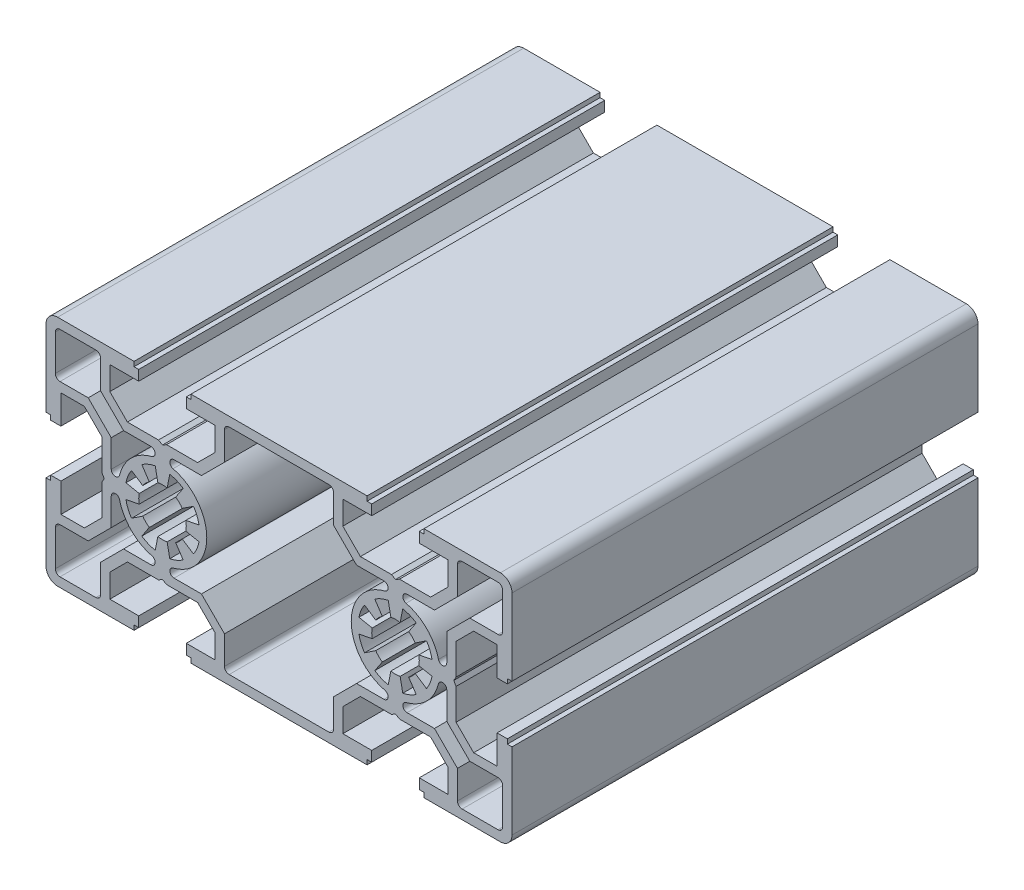
from build123d import *

# Parameters (mm, degrees)
EXTRUDE_1_DEPTH = 100


with BuildPart() as part:
    # 草图1 → 凸台-拉伸1 (new body)
    with BuildSketch(Plane.XY):
        with BuildLine():
            Line((75, 6.1), (75, 22.5))
            ThreePointArc((75, 22.5), (74.267766953, 24.267766953), (72.5, 25))
            Line((72.5, 25), (56.1, 25))
            Line((56.1, 25), (56.1, 24))
            Line((56.1, 24), (55.1, 24))
            Line((55.1, 24), (55.1, 21.8))
            Line((55.1, 21.8), (61.3, 21.8))
            Line((61.3, 21.8), (61.3, 16.769848481))
            Line((61.3, 16.769848481), (57.530151519, 13))
            Line((57.530151519, 13), (50.866025404, 13))
            Line((50.866025404, 13), (50, 12.5))
            Line((50, 12.5), (49.133974596, 13))
            Line((49.133974596, 13), (42.469848481, 13))
            Line((42.469848481, 13), (38.7, 16.769848481))
            Line((38.7, 16.769848481), (38.7, 21.8))
            Line((38.7, 21.8), (44.9, 21.8))
            Line((44.9, 21.8), (44.9, 24))
            Line((44.9, 24), (43.9, 24))
            Line((43.9, 24), (43.9, 25))
            Line((43.9, 25), (6.1, 25))
            Line((6.1, 25), (6.1, 24))
            Line((6.1, 24), (5.1, 24))
            Line((5.1, 24), (5.1, 21.8))
            Line((5.1, 21.8), (11.3, 21.8))
            Line((11.3, 21.8), (11.3, 16.769848481))
            Line((11.3, 16.769848481), (7.530151519, 13))
            Line((7.530151519, 13), (0.866025404, 13))
            Line((0.866025404, 13), (0, 12.5))
            Line((0, 12.5), (-0.866025404, 13))
            Line((-0.866025404, 13), (-7.530151519, 13))
            Line((-7.530151519, 13), (-11.3, 16.769848481))
            Line((-11.3, 16.769848481), (-11.3, 21.8))
            Line((-11.3, 21.8), (-5.1, 21.8))
            Line((-5.1, 21.8), (-5.1, 24))
            Line((-5.1, 24), (-6.1, 24))
            Line((-6.1, 24), (-6.1, 25))
            Line((-6.1, 25), (-22.5, 25))
            ThreePointArc((-22.5, 25), (-24.267766953, 24.267766953), (-25, 22.5))
            Line((-25, 22.5), (-25, 6.1))
            Line((-25, 6.1), (-24, 6.1))
            Line((-24, 6.1), (-24, 5.1))
            Line((-24, 5.1), (-21.8, 5.1))
            Line((-21.8, 5.1), (-21.8, 11.3))
            Line((-21.8, 11.3), (-16.769848481, 11.3))
            Line((-16.769848481, 11.3), (-13, 7.530151519))
            Line((-13, 7.530151519), (-13, 0.866025404))
            Line((-13, 0.866025404), (-12.5, 0))
            Line((-12.5, 0), (-13, -0.866025404))
            Line((-13, -0.866025404), (-13, -7.530151519))
            Line((-13, -7.530151519), (-16.769848481, -11.3))
            Line((-16.769848481, -11.3), (-21.8, -11.3))
            Line((-21.8, -11.3), (-21.8, -5.1))
            Line((-21.8, -5.1), (-24, -5.1))
            Line((-24, -5.1), (-24, -6.1))
            Line((-24, -6.1), (-25, -6.1))
            Line((-25, -6.1), (-25, -22.5))
            ThreePointArc((-25, -22.5), (-24.267766953, -24.267766953), (-22.5, -25))
            Line((-22.5, -25), (-6.1, -25))
            Line((-6.1, -25), (-6.1, -24))
            Line((-6.1, -24), (-5.1, -24))
            Line((-5.1, -24), (-5.1, -21.8))
            Line((-5.1, -21.8), (-11.3, -21.8))
            Line((-11.3, -21.8), (-11.3, -16.769848481))
            Line((-11.3, -16.769848481), (-7.530151519, -13))
            Line((-7.530151519, -13), (-0.866025404, -13))
            Line((-0.866025404, -13), (0, -12.5))
            Line((0, -12.5), (0.866025404, -13))
            Line((0.866025404, -13), (7.530151519, -13))
            Line((7.530151519, -13), (11.3, -16.769848481))
            Line((11.3, -16.769848481), (11.3, -21.8))
            Line((11.3, -21.8), (5.1, -21.8))
            Line((5.1, -21.8), (5.1, -24))
            Line((5.1, -24), (6.1, -24))
            Line((6.1, -24), (6.1, -25))
            Line((6.1, -25), (43.9, -25))
            Line((43.9, -25), (43.9, -24))
            Line((43.9, -24), (44.9, -24))
            Line((44.9, -24), (44.9, -21.8))
            Line((44.9, -21.8), (38.7, -21.8))
            Line((38.7, -21.8), (38.7, -16.769848481))
            Line((38.7, -16.769848481), (42.469848481, -13))
            Line((42.469848481, -13), (49.133974596, -13))
            Line((49.133974596, -13), (50, -12.5))
            Line((50, -12.5), (50.866025404, -13))
            Line((50.866025404, -13), (57.530151519, -13))
            Line((57.530151519, -13), (61.3, -16.769848481))
            Line((61.3, -16.769848481), (61.3, -21.8))
            Line((61.3, -21.8), (55.1, -21.8))
            Line((55.1, -21.8), (55.1, -24))
            Line((55.1, -24), (56.1, -24))
            Line((56.1, -24), (56.1, -25))
            Line((56.1, -25), (72.5, -25))
            ThreePointArc((72.5, -25), (74.267766953, -24.267766953), (75, -22.5))
            Line((75, -22.5), (75, -6.1))
            Line((75, -6.1), (74, -6.1))
            Line((74, -6.1), (74, -5.1))
            Line((74, -5.1), (71.8, -5.1))
            Line((71.8, -5.1), (71.8, -11.3))
            Line((71.8, -11.3), (66.769848481, -11.3))
            Line((66.769848481, -11.3), (63, -7.530151519))
            Line((63, -7.530151519), (63, -0.866025404))
            Line((63, -0.866025404), (62.5, 0))
            Line((62.5, 0), (63, 0.866025404))
            Line((63, 0.866025404), (63, 7.530151519))
            Line((63, 7.530151519), (66.769848481, 11.3))
            Line((66.769848481, 11.3), (71.8, 11.3))
            Line((71.8, 11.3), (71.8, 5.1))
            Line((71.8, 5.1), (74, 5.1))
            Line((74, 5.1), (74, 6.1))
            Line((74, 6.1), (75, 6.1))
        make_face()
        with BuildLine():
            Line((61, -2.479919354), (61, -8.358578644))
            Line((61, -8.358578644), (65.941421356, -13.3))
            Line((65.941421356, -13.3), (72, -13.3))
            ThreePointArc((72, -13.3), (72.707106781, -13.592893219), (73, -14.3))
            Line((73, -14.3), (73, -22))
            ThreePointArc((73, -22), (72.707106781, -22.707106781), (72, -23))
            Line((72, -23), (64.3, -23))
            ThreePointArc((64.3, -23), (63.592893219, -22.707106781), (63.3, -22))
            Line((63.3, -22), (63.3, -15.941421356))
            Line((63.3, -15.941421356), (58.358578644, -11))
            Line((58.358578644, -11), (52.479919354, -11))
            ThreePointArc((52.479919354, -11), (51.586433311, -10.208086504), (52.265310948, -9.225961538))
            ThreePointArc((52.265310948, -9.225961538), (56.717514421, -6.717514421), (59.225961538, -2.265310948))
            ThreePointArc((59.225961538, -2.265310948), (60.208086504, -1.586433311), (61, -2.479919354))
        make_face(mode=Mode.SUBTRACT)
        with BuildLine():
            Line((52.833408188, 4.240495023), (54.444561864, 6.651756898))
            ThreePointArc((54.444561864, 6.651756898), (53.061467459, 7.39103626), (51.560722576, 7.846282243))
            Line((51.560722576, 7.846282243), (50.994960642, 5.00200493))
            ThreePointArc((50.994960642, 5.00200493), (50, 5.1), (49.005039358, 5.00200493))
            Line((49.005039358, 5.00200493), (48.439277424, 7.846282243))
            ThreePointArc((48.439277424, 7.846282243), (46.938532541, 7.39103626), (45.555438136, 6.651756898))
            Line((45.555438136, 6.651756898), (47.166591812, 4.240495023))
            ThreePointArc((47.166591812, 4.240495023), (46.393755416, 3.606244584), (45.759504977, 2.833408188))
            Line((45.759504977, 2.833408188), (43.348243102, 4.444561864))
            ThreePointArc((43.348243102, 4.444561864), (42.60896374, 3.061467459), (42.153717757, 1.560722576))
            Line((42.153717757, 1.560722576), (44.99799507, 0.994960642))
            ThreePointArc((44.99799507, 0.994960642), (44.9, 0), (44.99799507, -0.994960642))
            Line((44.99799507, -0.994960642), (42.153717757, -1.560722576))
            ThreePointArc((42.153717757, -1.560722576), (42.60896374, -3.061467459), (43.348243102, -4.444561864))
            Line((43.348243102, -4.444561864), (45.759504977, -2.833408188))
            ThreePointArc((45.759504977, -2.833408188), (46.393755416, -3.606244584), (47.166591812, -4.240495023))
            Line((47.166591812, -4.240495023), (45.555438136, -6.651756898))
            ThreePointArc((45.555438136, -6.651756898), (46.938532541, -7.39103626), (48.439277424, -7.846282243))
            Line((48.439277424, -7.846282243), (49.005039358, -5.00200493))
            ThreePointArc((49.005039358, -5.00200493), (50, -5.1), (50.994960642, -5.00200493))
            Line((50.994960642, -5.00200493), (51.560722576, -7.846282243))
            ThreePointArc((51.560722576, -7.846282243), (53.061467459, -7.39103626), (54.444561864, -6.651756898))
            Line((54.444561864, -6.651756898), (52.833408188, -4.240495023))
            ThreePointArc((52.833408188, -4.240495023), (53.606244584, -3.606244584), (54.240495023, -2.833408188))
            Line((54.240495023, -2.833408188), (56.651756898, -4.444561864))
            ThreePointArc((56.651756898, -4.444561864), (57.39103626, -3.061467459), (57.846282243, -1.560722576))
            Line((57.846282243, -1.560722576), (55.00200493, -0.994960642))
            ThreePointArc((55.00200493, -0.994960642), (55.1, 0), (55.00200493, 0.994960642))
            Line((55.00200493, 0.994960642), (57.846282243, 1.560722576))
            ThreePointArc((57.846282243, 1.560722576), (57.39103626, 3.061467459), (56.651756898, 4.444561864))
            Line((56.651756898, 4.444561864), (54.240495023, 2.833408188))
            ThreePointArc((54.240495023, 2.833408188), (53.606244584, 3.606244584), (52.833408188, 4.240495023))
        make_face(mode=Mode.SUBTRACT)
        with BuildLine():
            Line((65.941421356, 13.3), (61, 8.358578644))
            Line((61, 8.358578644), (61, 2.479919354))
            ThreePointArc((61, 2.479919354), (60.208086504, 1.586433311), (59.225961538, 2.265310948))
            ThreePointArc((59.225961538, 2.265310948), (56.717514421, 6.717514421), (52.265310948, 9.225961538))
            ThreePointArc((52.265310948, 9.225961538), (51.586433311, 10.208086504), (52.479919354, 11))
            Line((52.479919354, 11), (58.358578644, 11))
            Line((58.358578644, 11), (63.3, 15.941421356))
            Line((63.3, 15.941421356), (63.3, 22))
            ThreePointArc((63.3, 22), (63.592893219, 22.707106781), (64.3, 23))
            Line((64.3, 23), (72, 23))
            ThreePointArc((72, 23), (72.707106781, 22.707106781), (73, 22))
            Line((73, 22), (73, 14.3))
            ThreePointArc((73, 14.3), (72.707106781, 13.592893219), (72, 13.3))
            Line((72, 13.3), (65.941421356, 13.3))
        make_face(mode=Mode.SUBTRACT)
        with BuildLine():
            Line((47.520080646, -11), (41.641421356, -11))
            Line((41.641421356, -11), (36.7, -15.941421356))
            Line((36.7, -15.941421356), (36.7, -22))
            ThreePointArc((36.7, -22), (36.407106781, -22.707106781), (35.7, -23))
            Line((35.7, -23), (14.3, -23))
            ThreePointArc((14.3, -23), (13.592893219, -22.707106781), (13.3, -22))
            Line((13.3, -22), (13.3, -15.941421356))
            Line((13.3, -15.941421356), (8.358578644, -11))
            Line((8.358578644, -11), (2.479919354, -11))
            ThreePointArc((2.479919354, -11), (1.586433311, -10.208086504), (2.265310948, -9.225961538))
            ThreePointArc((2.265310948, -9.225961538), (8.1255567, -4.921923234), (9.225961538, 2.265310948))
            ThreePointArc((9.225961538, 2.265310948), (6.717514421, 6.717514421), (2.265310948, 9.225961538))
            ThreePointArc((2.265310948, 9.225961538), (1.586433311, 10.208086504), (2.479919354, 11))
            Line((2.479919354, 11), (8.358578644, 11))
            Line((8.358578644, 11), (13.3, 15.941421356))
            Line((13.3, 15.941421356), (13.3, 22))
            ThreePointArc((13.3, 22), (13.592893219, 22.707106781), (14.3, 23))
            Line((14.3, 23), (35.7, 23))
            ThreePointArc((35.7, 23), (36.407106781, 22.707106781), (36.7, 22))
            Line((36.7, 22), (36.7, 15.941421356))
            Line((36.7, 15.941421356), (41.641421356, 11))
            Line((41.641421356, 11), (47.520080646, 11))
            ThreePointArc((47.520080646, 11), (48.413566689, 10.208086504), (47.734689052, 9.225961538))
            ThreePointArc((47.734689052, 9.225961538), (43.282485579, 6.717514421), (40.774038462, 2.265310948))
            ThreePointArc((40.774038462, 2.265310948), (41.8744433, -4.921923234), (47.734689052, -9.225961538))
            ThreePointArc((47.734689052, -9.225961538), (48.413566689, -10.208086504), (47.520080646, -11))
        make_face(mode=Mode.SUBTRACT)
        with BuildLine():
            Line((-11, -2.479919354), (-11, -8.358578644))
            Line((-11, -8.358578644), (-15.941421356, -13.3))
            Line((-15.941421356, -13.3), (-22, -13.3))
            ThreePointArc((-22, -13.3), (-22.707106781, -13.592893219), (-23, -14.3))
            Line((-23, -14.3), (-23, -22))
            ThreePointArc((-23, -22), (-22.707106781, -22.707106781), (-22, -23))
            Line((-22, -23), (-14.3, -23))
            ThreePointArc((-14.3, -23), (-13.592893219, -22.707106781), (-13.3, -22))
            Line((-13.3, -22), (-13.3, -15.941421356))
            Line((-13.3, -15.941421356), (-8.358578644, -11))
            Line((-8.358578644, -11), (-2.479919354, -11))
            ThreePointArc((-2.479919354, -11), (-1.586433311, -10.208086504), (-2.265310948, -9.225961538))
            ThreePointArc((-2.265310948, -9.225961538), (-6.717514421, -6.717514421), (-9.225961538, -2.265310948))
            ThreePointArc((-9.225961538, -2.265310948), (-10.208086504, -1.586433311), (-11, -2.479919354))
        make_face(mode=Mode.SUBTRACT)
        with BuildLine():
            Line((-4.240495023, 2.833408188), (-6.651756898, 4.444561864))
            ThreePointArc((-6.651756898, 4.444561864), (-7.39103626, 3.061467459), (-7.846282243, 1.560722576))
            Line((-7.846282243, 1.560722576), (-5.00200493, 0.994960642))
            ThreePointArc((-5.00200493, 0.994960642), (-5.1, 0), (-5.00200493, -0.994960642))
            Line((-5.00200493, -0.994960642), (-7.846282243, -1.560722576))
            ThreePointArc((-7.846282243, -1.560722576), (-7.39103626, -3.061467459), (-6.651756898, -4.444561864))
            Line((-6.651756898, -4.444561864), (-4.240495023, -2.833408188))
            ThreePointArc((-4.240495023, -2.833408188), (-3.606244584, -3.606244584), (-2.833408188, -4.240495023))
            Line((-2.833408188, -4.240495023), (-4.444561864, -6.651756898))
            ThreePointArc((-4.444561864, -6.651756898), (-3.061467459, -7.39103626), (-1.560722576, -7.846282243))
            Line((-1.560722576, -7.846282243), (-0.994960642, -5.00200493))
            ThreePointArc((-0.994960642, -5.00200493), (0, -5.1), (0.994960642, -5.00200493))
            Line((0.994960642, -5.00200493), (1.560722576, -7.846282243))
            ThreePointArc((1.560722576, -7.846282243), (3.061467459, -7.39103626), (4.444561864, -6.651756898))
            Line((4.444561864, -6.651756898), (2.833408188, -4.240495023))
            ThreePointArc((2.833408188, -4.240495023), (3.606244584, -3.606244584), (4.240495023, -2.833408188))
            Line((4.240495023, -2.833408188), (6.651756898, -4.444561864))
            ThreePointArc((6.651756898, -4.444561864), (7.39103626, -3.061467459), (7.846282243, -1.560722576))
            Line((7.846282243, -1.560722576), (5.00200493, -0.994960642))
            ThreePointArc((5.00200493, -0.994960642), (5.1, 0), (5.00200493, 0.994960642))
            Line((5.00200493, 0.994960642), (7.846282243, 1.560722576))
            ThreePointArc((7.846282243, 1.560722576), (7.39103626, 3.061467459), (6.651756898, 4.444561864))
            Line((6.651756898, 4.444561864), (4.240495023, 2.833408188))
            ThreePointArc((4.240495023, 2.833408188), (3.606244584, 3.606244584), (2.833408188, 4.240495023))
            Line((2.833408188, 4.240495023), (4.444561864, 6.651756898))
            ThreePointArc((4.444561864, 6.651756898), (3.061467459, 7.39103626), (1.560722576, 7.846282243))
            Line((1.560722576, 7.846282243), (0.994960642, 5.00200493))
            ThreePointArc((0.994960642, 5.00200493), (0, 5.1), (-0.994960642, 5.00200493))
            Line((-0.994960642, 5.00200493), (-1.560722576, 7.846282243))
            ThreePointArc((-1.560722576, 7.846282243), (-3.061467459, 7.39103626), (-4.444561864, 6.651756898))
            Line((-4.444561864, 6.651756898), (-2.833408188, 4.240495023))
            ThreePointArc((-2.833408188, 4.240495023), (-3.606244584, 3.606244584), (-4.240495023, 2.833408188))
        make_face(mode=Mode.SUBTRACT)
        with BuildLine():
            Line((-15.941421356, 13.3), (-11, 8.358578644))
            Line((-11, 8.358578644), (-11, 2.479919354))
            ThreePointArc((-11, 2.479919354), (-10.208086504, 1.586433311), (-9.225961538, 2.265310948))
            ThreePointArc((-9.225961538, 2.265310948), (-6.717514421, 6.717514421), (-2.265310948, 9.225961538))
            ThreePointArc((-2.265310948, 9.225961538), (-1.586433311, 10.208086504), (-2.479919354, 11))
            Line((-2.479919354, 11), (-8.358578644, 11))
            Line((-8.358578644, 11), (-13.3, 15.941421356))
            Line((-13.3, 15.941421356), (-13.3, 22))
            ThreePointArc((-13.3, 22), (-13.592893219, 22.707106781), (-14.3, 23))
            Line((-14.3, 23), (-22, 23))
            ThreePointArc((-22, 23), (-22.707106781, 22.707106781), (-23, 22))
            Line((-23, 22), (-23, 14.3))
            ThreePointArc((-23, 14.3), (-22.707106781, 13.592893219), (-22, 13.3))
            Line((-22, 13.3), (-15.941421356, 13.3))
        make_face(mode=Mode.SUBTRACT)
    extrude(amount=EXTRUDE_1_DEPTH)


solid = part.part
